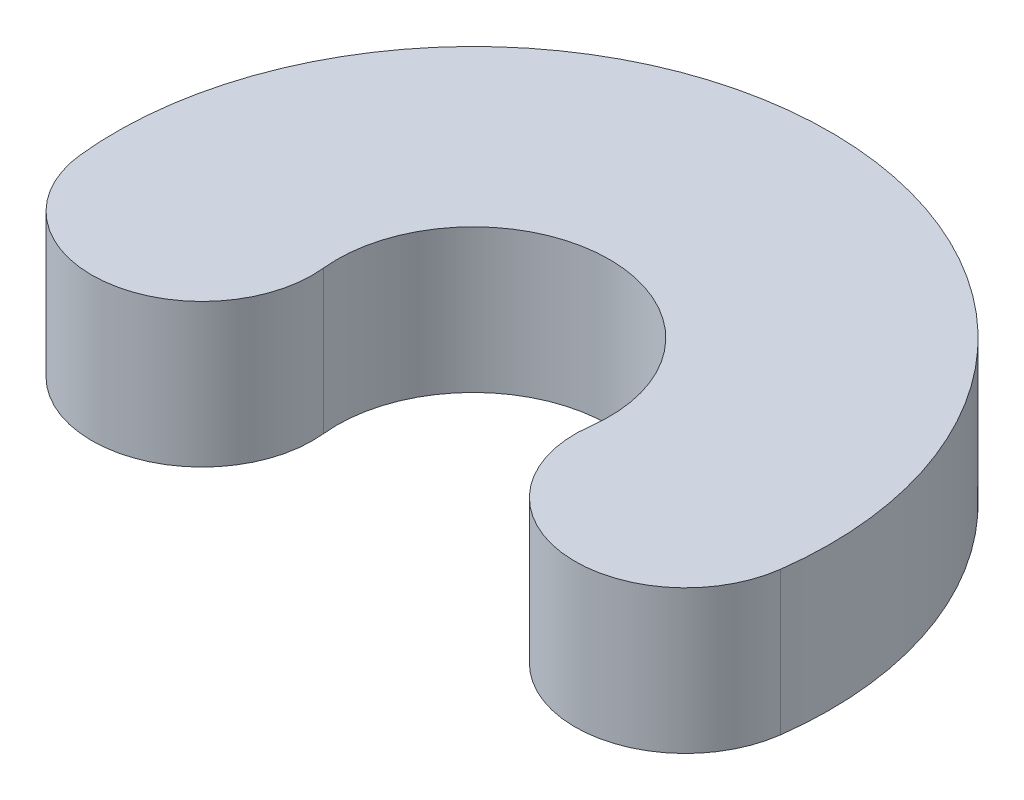
from build123d import *

# Parameters (mm, degrees)
BOSS_EXTRUDE1_DEPTH = 33
SHELL1_T            = -10


with BuildPart() as part:
    # Sketch1 → Boss-Extrude1 (new body)
    with BuildSketch(Plane(origin=(0, 0, 0), x_dir=(1, 0, 0), z_dir=(0, 1, 0))):
        with BuildLine():
            ThreePointArc((81.419785193, -10.723465188), (1.062753422, 82.116043997), (-81.670036167, -8.612741664))
            ThreePointArc((-81.670036167, -8.612741664), (-53.746253944, -31.208811817), (-31.150183791, -3.285029594))
            ThreePointArc((-31.150183791, -3.285029594), (0.405350187, 31.320297905), (31.054734295, -4.090091387))
            ThreePointArc((31.054734295, -4.090091387), (52.920572843, -32.589303736), (81.419785193, -10.723465188))
        make_face()
    extrude(amount=BOSS_EXTRUDE1_DEPTH)

    # Shell1
    shell1_openings = [part.faces().sort_by_distance(p)[0] for p in [
        (-53.956492273, 0, 29.21523386),
    ]]
    offset(amount=SHELL1_T, openings=shell1_openings, kind=Kind.INTERSECTION)


solid = part.part
